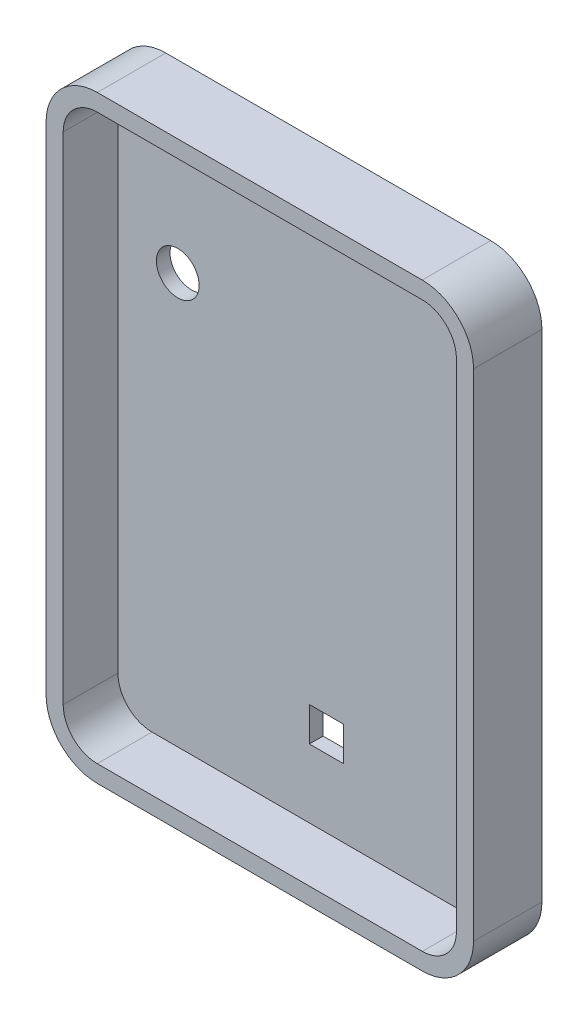
from build123d import *

# Parameters (mm, degrees)
SKETCH1_W           = 63.5
SKETCH1_H           = 88.9
BOSS_EXTRUDE1_DEPTH = 10.16
FILLET1_R           = 7.62
CUT_EXTRUDE1_DEPTH  = 8.128
SKETCH3_W           = 5.08
SKETCH3_H           = 5.08
SKETCH3_R           = 3.175
CUT_EXTRUDE2_DEPTH  = 12.7


with BuildPart() as part:
    # Sketch1 → Boss-Extrude1 (new body)
    with BuildSketch(Plane.XY):
        with Locations((31.75, -44.45)):
            Rectangle(SKETCH1_W, SKETCH1_H)
    extrude(amount=BOSS_EXTRUDE1_DEPTH)

    # Fillet1
    fillet1_edges = [part.edges().sort_by_distance(p)[0] for p in [
        (0, 0, 5.08),
        (63.5, 0, 5.08),
        (63.5, -88.9, 5.08),
        (0, -88.9, 5.08),
    ]]
    fillet(fillet1_edges, radius=FILLET1_R)

    # Sketch2 → Cut-Extrude1 (cut)
    with BuildSketch(Plane.XY.offset(10.16)):
        with BuildLine():
            Line((7.62, -2.54), (55.88, -2.54))
            ThreePointArc((55.88, -2.54), (59.472102448, -4.027897552), (60.96, -7.62))
            Line((60.96, -7.62), (60.96, -81.296436042))
            ThreePointArc((60.96, -81.296436042), (59.476916454, -84.876916454), (55.896436042, -86.36))
            Line((55.896436042, -86.36), (7.603563958, -86.36))
            ThreePointArc((7.603563958, -86.36), (4.023083546, -84.876916454), (2.54, -81.296436042))
            Line((2.54, -81.296436042), (2.54, -7.62))
            ThreePointArc((2.54, -7.62), (4.027897552, -4.027897552), (7.62, -2.54))
        make_face()
    extrude(amount=-CUT_EXTRUDE1_DEPTH, mode=Mode.SUBTRACT)

    # Sketch3 → Cut-Extrude2 (cut)
    with BuildSketch(Plane(origin=(0, 0, 0), x_dir=(-1, 0, 0), z_dir=(0, 0, -1))):
        with Locations((-33.528, -73.66)):
            Rectangle(SKETCH3_W, SKETCH3_H)
        with Locations((-11.43, -25.4)):
            Circle(SKETCH3_R)
    extrude(amount=-CUT_EXTRUDE2_DEPTH, mode=Mode.SUBTRACT)


solid = part.part
